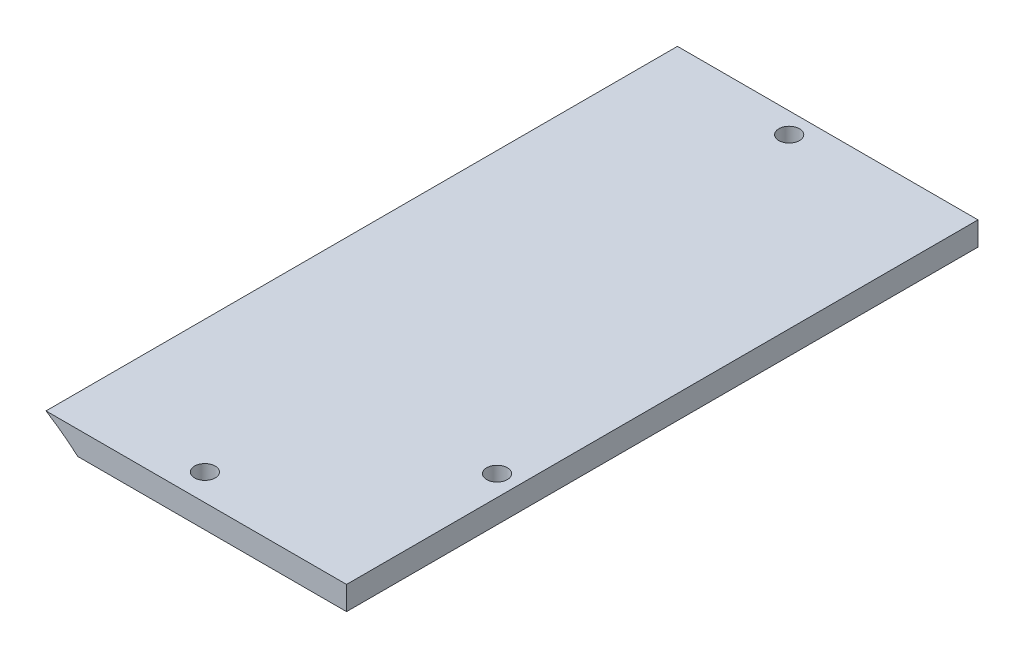
from build123d import *
from build123d.topology import SkipClean

# Parameters (mm, degrees)
SKETCH1_R                      = 40
SKETCH1_R_2                    = 38
BOSS_EXTRUDE1_DEPTH            = 200
SKETCH2_R                      = 40
BOSS_EXTRUDE2_DEPTH            = 2
BOSS_EXTRUDE3_DEPTH            = 107
BOSS_EXTRUDE4_DEPTH            = 2
SKETCH5_R                      = 1.75
CUT_EXTRUDE1_DEPTH             = 226.077764339
CUT_EXTRUDE2_REACH             = 218.296
SKETCH6_R                      = 4
CUT_EXTRUDE2_DIRECTION_2_REACH = 218.296
CIRPATTERN1_COUNT              = 2
CIRPATTERN1_ANGLE              = 90
BOSS_EXTRUDE5_REACH            = 241.742
BOSS_EXTRUDE5_END_RADIUS       = 40
SKETCH7_W                      = 14
SKETCH7_H                      = 2
CUT_EXTRUDE3_REACH             = 221.073
SKETCH8_R                      = 1.75
FILLET1_R                      = 3
CUT_EXTRUDE4_REACH             = 220.598
SKETCH9_R                      = 0.25
BOSS_EXTRUDE6_START            = 2
BOSS_EXTRUDE6_DEPTH            = 2
SKETCH11_R                     = 38
CUT_EXTRUDE5_DEPTH             = 219.146739623
CUT_EXTRUDE6_DEPTH             = 2


with BuildPart() as part:
    # Sketch1 → Boss-Extrude1 (new body)
    with BuildSketch(Plane.XY):
        Circle(SKETCH1_R)
        Circle(SKETCH1_R_2, mode=Mode.SUBTRACT)
    extrude(amount=BOSS_EXTRUDE1_DEPTH)

    # Sketch2 → Boss-Extrude2 (add)
    with BuildSketch(Plane.XY.offset(180)):
        Circle(SKETCH2_R)
    extrude(amount=BOSS_EXTRUDE2_DEPTH)

    # Sketch3 → Boss-Extrude3 (add)
    with BuildSketch(Plane(origin=(0, 0, 0), x_dir=(-1, 0, 0), z_dir=(0, 0, -1))):
        with BuildLine():
            Line((-21.071307506, -34), (-72, -34))
            Line((-72, -34), (-72, -30))
            Line((-72, -30), (-26.457513111, -30))
            ThreePointArc((-26.457513111, -30), (-23.848421275, -32.113125085), (-21.071307506, -34))
        make_face()
        with BuildLine():
            Line((-21.071307506, 34), (-72, 34))
            Line((-72, 34), (-72, 30))
            Line((-72, 30), (-26.457513111, 30))
            ThreePointArc((-26.457513111, 30), (-23.848421275, 32.113125085), (-21.071307506, 34))
        make_face()
    extrude(amount=-BOSS_EXTRUDE3_DEPTH)

    # Sketch4 → Boss-Extrude4 (add)
    with BuildSketch(Plane.XY.offset(107)):
        with BuildLine():
            Line((72, -34), (21.071307506, -34))
            ThreePointArc((21.071307506, -34), (40, 0), (21.071307506, 34))
            Line((21.071307506, 34), (72, 34))
            Line((72, 34), (72, -34))
        make_face()
    extrude(amount=BOSS_EXTRUDE4_DEPTH)

    # Sketch5 → Cut-Extrude1 (cut, through all)
    with BuildSketch(Plane(origin=(0, 34, 0), x_dir=(1, 0, 0), z_dir=(0, 1, 0))):
        with Locations(Location((43.5, -102.5, 0), (0, 0, 270))):
            Circle(SKETCH5_R)
        with Locations(Location((43.5, -3.5, 0), (0, 0, 270))):
            Circle(SKETCH5_R)
        with Locations(Location((68.5, -78, 0), (0, 0, 270))):
            Circle(SKETCH5_R)
    extrude(amount=-CUT_EXTRUDE1_DEPTH, mode=Mode.SUBTRACT)

    # Sketch6 → Cut-Extrude2 (cut, up to next)
    with BuildSketch(Plane(origin=(0, 0, 0), x_dir=(0, 0, 1), z_dir=(-0.7071067811865488, 0.7071067811865464, 0)), mode=Mode.PRIVATE) as cut_extrude2_sk1:
        with Locations(Location((187, 0, 0), (0, 0, 90))):
            Circle(SKETCH6_R)
    cut_extrude2_tool1 = extrude(cut_extrude2_sk1.sketch, amount=-CUT_EXTRUDE2_REACH, mode=Mode.PRIVATE) & part.part
    cut_extrude2 = cut_extrude2_tool1.solids().sort_by_distance((0, 0, 187))[0]
    add(cut_extrude2, mode=Mode.SUBTRACT)

    # Sketch6 → Cut-Extrude2 direction 2 (cut, up to next)
    with BuildSketch(Plane(origin=(0, 0, 0), x_dir=(0, 0, 1), z_dir=(-0.7071067811865488, 0.7071067811865464, 0)), mode=Mode.PRIVATE) as cut_extrude2_direction_2_sk1:
        with Locations(Location((187, 0, 0), (0, 0, 90))):
            Circle(SKETCH6_R)
    cut_extrude2_direction_2_tool1 = extrude(cut_extrude2_direction_2_sk1.sketch, amount=CUT_EXTRUDE2_DIRECTION_2_REACH, mode=Mode.PRIVATE) & part.part
    cut_extrude2_direction_2 = cut_extrude2_direction_2_tool1.solids().sort_by_distance((0, 0, 187))[0]
    add(cut_extrude2_direction_2, mode=Mode.SUBTRACT)

    # CirPattern1: Cut-Extrude2, Cut-Extrude2 direction 2 ×2 about axis
    cirpattern1_axis = Axis((0, 0, -5.35), (0, 0, 1))
    add([cut_extrude2.rotate(cirpattern1_axis, i * CIRPATTERN1_ANGLE / (CIRPATTERN1_COUNT - 1)) for i in range(1, CIRPATTERN1_COUNT)], mode=Mode.SUBTRACT)
    add([cut_extrude2_direction_2.rotate(cirpattern1_axis, i * CIRPATTERN1_ANGLE / (CIRPATTERN1_COUNT - 1)) for i in range(1, CIRPATTERN1_COUNT)], mode=Mode.SUBTRACT)

    # Boss-Extrude5: up to this cylinder (the profile starts outside it)
    boss_extrude5_end = Plane(origin=(0, 0, 7), z_dir=(0, 0, -1)) * Cylinder(BOSS_EXTRUDE5_END_RADIUS, 564.484, mode=Mode.PRIVATE)
    # Sketch7 → Boss-Extrude5 (add, up to the surface)
    with BuildSketch(Plane(origin=(-54, 0, 0), x_dir=(0, 0, -1), z_dir=(1, 0, 0)), mode=Mode.PRIVATE) as boss_extrude5_sk1:
        with Locations((-7, -12)):
            Rectangle(SKETCH7_W, SKETCH7_H)
    boss_extrude5_tool1 = extrude(boss_extrude5_sk1.sketch, amount=BOSS_EXTRUDE5_REACH, mode=Mode.PRIVATE) - boss_extrude5_end
    add(boss_extrude5_tool1.solids().sort_by_distance((-54, -12, 7))[0])
    # Sketch7 → Boss-Extrude5 (add, up to the surface)
    with BuildSketch(Plane(origin=(-54, 0, 0), x_dir=(0, 0, -1), z_dir=(1, 0, 0)), mode=Mode.PRIVATE) as boss_extrude5_sk2:
        with Locations((-7, 12)):
            Rectangle(SKETCH7_W, SKETCH7_H)
    boss_extrude5_tool2 = extrude(boss_extrude5_sk2.sketch, amount=BOSS_EXTRUDE5_REACH, mode=Mode.PRIVATE) - boss_extrude5_end
    add(boss_extrude5_tool2.solids().sort_by_distance((-54, 12, 7))[0])

    # Cut-Extrude3: up to this face of the body (flat: up to its plane)
    cut_extrude3_end = Plane(part.part.faces().sort_by_distance((-45.914280319, 13, 7))[0])
    # Sketch8 → Cut-Extrude3 (cut, up to the picked face)
    with BuildSketch(Plane.XZ.offset(13), mode=Mode.PRIVATE) as cut_extrude3_sk1:
        with Locations(Location((-49.770305539, 5.008755099, 0), (0, 0, 270))):
            Circle(SKETCH8_R)
    cut_extrude3_tool1 = split(extrude(cut_extrude3_sk1.sketch, amount=-CUT_EXTRUDE3_REACH, mode=Mode.PRIVATE), bisect_by=cut_extrude3_end, keep=Keep.BOTH, mode=Mode.PRIVATE)
    add(cut_extrude3_tool1.solids().sort_by(Axis((-49.770306, -13, 5.008755), (0, 1, 0)))[0], mode=Mode.SUBTRACT)

    # Fillet1
    fillet1_edges = [part.edges().sort_by_distance(p)[0] for p in [
        (-54, -12, 14),
        (-54, -12, 0),
        (-54, 12, 0),
        (-54, 12, 14),
    ]]
    fillet(fillet1_edges, radius=FILLET1_R)

    # Sketch9 → Cut-Extrude4 (cut, up to next)
    with BuildSketch(Plane.XZ.offset(-11), mode=Mode.PRIVATE) as cut_extrude4_sk1:
        with Locations(Location((-43.770305539, 7.008755099, 0), (0, 0, 270))):
            Circle(SKETCH9_R)
    cut_extrude4_tool1 = extrude(cut_extrude4_sk1.sketch, amount=-CUT_EXTRUDE4_REACH, mode=Mode.PRIVATE) & part.part
    add(cut_extrude4_tool1.solids().sort_by_distance((-43.770306, 11, 7.008755))[0], mode=Mode.SUBTRACT)

    # Sketch10 → Boss-Extrude6 (add)
    with SkipClean():  # the faces are left unmerged after this step: merging them gives an invalid solid
        with BuildSketch(Plane(origin=(0, 0, 0), x_dir=(-1, 0, 0), z_dir=(0, 0, -1)).offset(BOSS_EXTRUDE6_START)):
            with BuildLine():
                ThreePointArc((10, -36.66060556), (0, -38), (-10, -36.66060556))
                Line((-10, -36.66060556), (-10, -38.729833462))
                ThreePointArc((-10, -38.729833462), (0, -40), (10, -38.729833462))
                Line((10, -38.729833462), (10, -36.66060556))
            make_face()
            with BuildLine():
                ThreePointArc((10, 38.729833462), (0, 40), (-10, 38.729833462))
                Line((-10, 38.729833462), (-10, 36.66060556))
                ThreePointArc((-10, 36.66060556), (0, 38), (10, 36.66060556))
                Line((10, 36.66060556), (10, 38.729833462))
            make_face()
        extrude(amount=-BOSS_EXTRUDE6_DEPTH)

    # Sketch11 → Cut-Extrude5 (cut, through all)
    # profile 1 of 4: a face of its own
    with BuildSketch(Plane.XY.offset(200)):
        with BuildLine():
            ThreePointArc((-1.947772516, -39.952549133), (-40, 0), (-1.947772516, 39.952549133))
            ThreePointArc((-1.947772516, 39.952549133), (-79.070653643, 0), (-1.947772516, -39.952549133))
        make_face()
    # profile 2 of 4: a face of its own
    with BuildSketch(Plane.XY.offset(200)):
        with BuildLine():
            ThreePointArc((40, 0), (36.457513111, 16.457513111), (26.457513111, 30))
            ThreePointArc((26.457513111, 30), (23.848421275, 32.113125085), (21.071307506, 34))
            ThreePointArc((21.071307506, 34), (10.014270214, 38.726146104), (-1.947772516, 39.952549133))
            ThreePointArc((-1.947772516, 39.952549133), (-40, 0), (-1.947772516, -39.952549133))
            ThreePointArc((-1.947772516, -39.952549133), (10.014270214, -38.726146104), (21.071307506, -34))
            ThreePointArc((21.071307506, -34), (34.94890771, -19.456974325), (40, 0))
        make_face()
        Circle(SKETCH11_R, mode=Mode.SUBTRACT)
    # profile 3 of 4: a face of its own
    with BuildSketch(Plane.XY.offset(200)):
        with BuildLine():
            Line((72, -34), (72, 30))
            Line((72, 30), (26.457513111, 30))
            ThreePointArc((26.457513111, 30), (36.457513111, 16.457513111), (40, 0))
            ThreePointArc((40, 0), (34.94890771, -19.456974325), (21.071307506, -34))
            Line((21.071307506, -34), (72, -34))
        make_face()
    # profile 4 of 4: a face of its own
    with BuildSketch(Plane.XY.offset(200)):
        Circle(SKETCH11_R)
    extrude(amount=-CUT_EXTRUDE5_DEPTH, mode=Mode.SUBTRACT)

    # Sketch12 → Cut-Extrude6 (cut)
    with BuildSketch(Plane.XY.offset(109)):
        with BuildLine():
            Line((26.457513111, 30), (72, 30))
            Line((72, 30), (72, 34))
            Line((72, 34), (21.071307506, 34))
            ThreePointArc((21.071307506, 34), (23.848421275, 32.113125085), (26.457513111, 30))
        make_face()
    extrude(amount=-CUT_EXTRUDE6_DEPTH, mode=Mode.SUBTRACT)


solid = part.part
